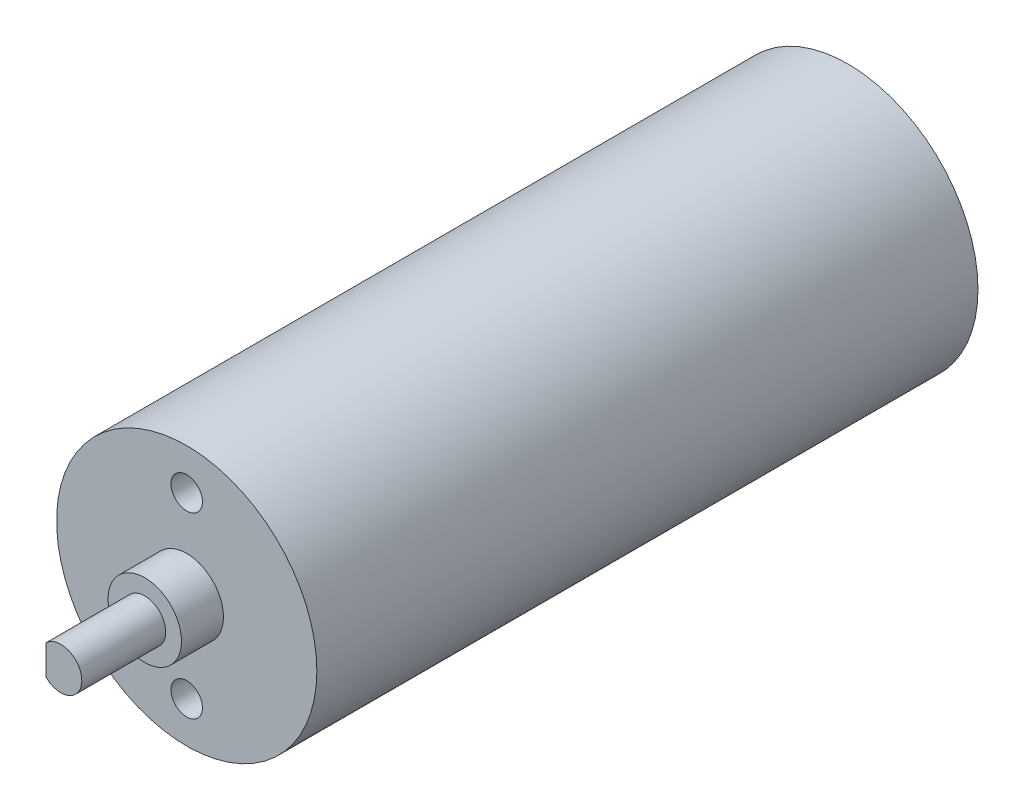
from build123d import *

# Parameters (mm, degrees)
SKETCH_1_R          = 12.4
EXTRUDE_1_DEPTH     = 63
SKETCH_2_R          = 3.5
EXTRUDE_2_DEPTH     = 4
EXTRUDE_3_DEPTH     = 8
SKETCH_4_R          = 1.5
CUT_EXTRUDE_1_DEPTH = 10


with BuildPart() as part:
    # 草图1 → 凸台-拉伸1 (new body)
    with BuildSketch(Plane.XY):
        Circle(SKETCH_1_R)
    extrude(amount=EXTRUDE_1_DEPTH)

    # 草图2 → 凸台-拉伸2 (add)
    with BuildSketch(Plane.XY.offset(63)):
        Circle(SKETCH_2_R)
    extrude(amount=EXTRUDE_2_DEPTH)

    # 草图3 → 凸台-拉伸3 (add)
    with BuildSketch(Plane.XY.offset(67)):
        with BuildLine():
            Line((-1.41, 1.418414608), (-1.41, -1.418414608))
            ThreePointArc((-1.41, -1.418414608), (2, 0), (-1.41, 1.418414608))
        make_face()
    extrude(amount=EXTRUDE_3_DEPTH)

    # 草图4 → 切除-拉伸1 (cut)
    with BuildSketch(Plane.XY.offset(63)):
        with Locations((0, -8.5)):
            Circle(SKETCH_4_R)
        with Locations((0, 8.5)):
            Circle(SKETCH_4_R)
    extrude(amount=-CUT_EXTRUDE_1_DEPTH, mode=Mode.SUBTRACT)


solid = part.part
